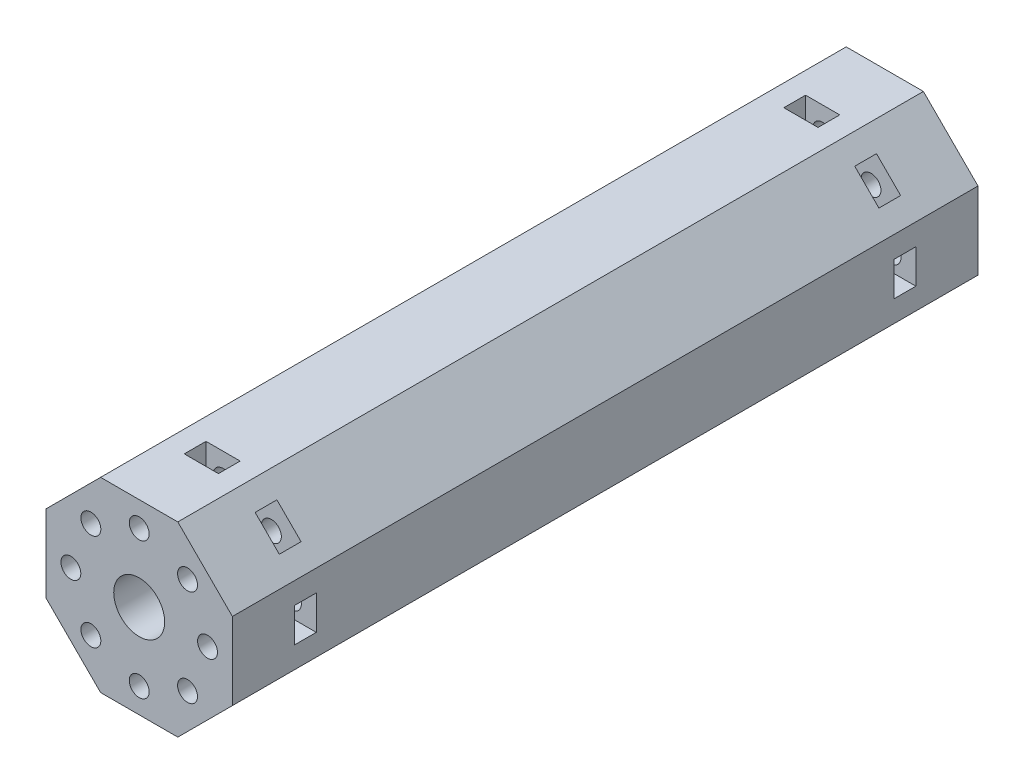
from build123d import *

# Parameters (mm, degrees)
SALIENTE_EXTRUIR1_DEPTH = 60
CROQUIS2_R              = 1.6
CORTAR_EXTRUIR1_DEPTH   = 20
CORTAR_EXTRUIR2_START   = -10
CORTAR_EXTRUIR2_DEPTH   = 3.5
CROQUIS4_R              = 4.1
CORTAR_EXTRUIR3_DEPTH   = 122.86057607


with BuildPart() as part:
    # Croquis1 → Saliente-Extruir1 (new body)
    with BuildSketch(Plane.XY):
        Polygon((15, -6.213203436), (15, 6.213203436), (6.213203436, 15), (-6.213203436, 15), (-15, 6.213203436), (-15, -6.213203436), (-6.213203436, -15), (6.213203436, -15), align=None)
    saliente_extruir1 = extrude(amount=SALIENTE_EXTRUIR1_DEPTH)

    # Croquis2 → Cortar-Extruir1 (cut)
    with BuildSketch(Plane(origin=(0, 0, 0), x_dir=(-1, 0, 0), z_dir=(0, 0, -1))):
        with Locations((0, 11)):
            Circle(CROQUIS2_R)
        with Locations((7.778174593, 7.778174593)):
            Circle(CROQUIS2_R)
        with Locations((11, 0)):
            Circle(CROQUIS2_R)
        with Locations((7.778174593, -7.778174593)):
            Circle(CROQUIS2_R)
        with Locations((0, -11)):
            Circle(CROQUIS2_R)
        with Locations((-7.778174593, -7.778174593)):
            Circle(CROQUIS2_R)
        with Locations((-11, 0)):
            Circle(CROQUIS2_R)
        with Locations((-7.778174593, 7.778174593)):
            Circle(CROQUIS2_R)
    cortar_extruir1 = extrude(amount=-CORTAR_EXTRUIR1_DEPTH, mode=Mode.SUBTRACT)

    # Croquis3 → Cortar-Extruir2 (cut)
    with BuildSketch(Plane(origin=(0, 0, 0), x_dir=(-1, 0, 0), z_dir=(0, 0, -1)).offset(CORTAR_EXTRUIR2_START)):
        Polygon((-2.75, 12.58771324), (-2.75, 18.463203436), (2.75, 23.963203436), (2.75, 12.58771324), (2.75, 9.41228676), (0, 7.824573519), (-2.75, 9.41228676), align=None)
        Polygon((6.956313744, 10.84540104), (11.110912703, 15), (18.889087297, 15), (10.84540104, 6.956313744), (8.600035443, 4.710948146), (5.532808996, 5.532808996), (4.710948146, 8.600035443), align=None)
        Polygon((12.58771324, 2.75), (18.463203436, 2.75), (23.963203436, -2.75), (12.58771324, -2.75), (9.41228676, -2.75), (7.824573519, 0), (9.41228676, 2.75), align=None)
        Polygon((10.84540104, -6.956313744), (15, -11.110912703), (15, -18.889087297), (6.956313744, -10.84540104), (4.710948146, -8.600035443), (5.532808996, -5.532808996), (8.600035443, -4.710948146), align=None)
        Polygon((2.75, -12.58771324), (2.75, -18.463203436), (-2.75, -23.963203436), (-2.75, -12.58771324), (-2.75, -9.41228676), (0, -7.824573519), (2.75, -9.41228676), align=None)
        Polygon((-6.956313744, -10.84540104), (-11.110912703, -15), (-18.889087297, -15), (-10.84540104, -6.956313744), (-8.600035443, -4.710948146), (-5.532808995, -5.532808996), (-4.710948146, -8.600035443), align=None)
        Polygon((-12.58771324, -2.75), (-18.463203436, -2.75), (-23.963203436, 2.75), (-12.58771324, 2.75), (-9.41228676, 2.75), (-7.824573519, 0), (-9.41228676, -2.75), align=None)
        Polygon((-10.84540104, 6.956313744), (-15, 11.110912703), (-15, 18.889087297), (-6.956313744, 10.84540104), (-4.710948146, 8.600035443), (-5.532808996, 5.532808996), (-8.600035443, 4.710948146), align=None)
    cortar_extruir2 = extrude(amount=-CORTAR_EXTRUIR2_DEPTH, mode=Mode.SUBTRACT)

    # Simetría1: Saliente-Extruir1, Cortar-Extruir1, Cortar-Extruir2 across plane
    add(saliente_extruir1.mirror(Plane.XY.offset(60)))
    add(cortar_extruir1.mirror(Plane.XY.offset(60)), mode=Mode.SUBTRACT)
    add(cortar_extruir2.mirror(Plane.XY.offset(60)), mode=Mode.SUBTRACT)

    # Croquis4 → Cortar-Extruir3 (cut, through all)
    with BuildSketch(Plane(origin=(0, 0, 0), x_dir=(-1, 0, 0), z_dir=(0, 0, -1))):
        Circle(CROQUIS4_R)
    extrude(amount=-CORTAR_EXTRUIR3_DEPTH, mode=Mode.SUBTRACT)


solid = part.part
